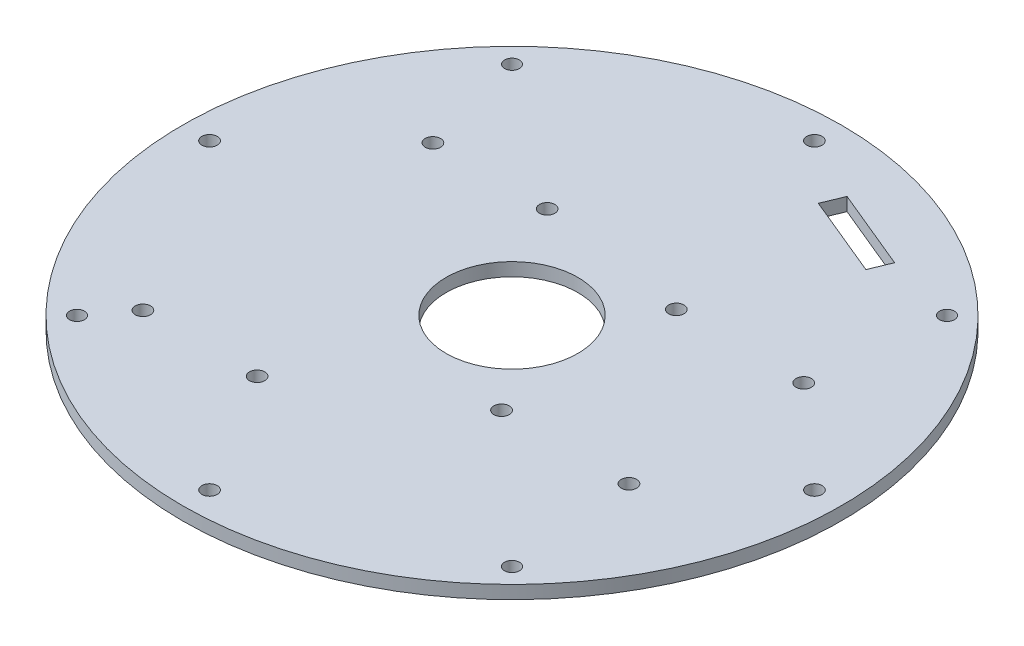
from build123d import *

# Parameters (mm, degrees)
SKETCH1_R           = 75
SKETCH1_R_2         = 1.7
SKETCH1_R_3         = 15
BOSS_EXTRUDE1_DEPTH = 3
SKETCH2_R           = 1.75
CUT_EXTRUDE2_DEPTH  = 107.108435103
SKETCH3_R           = 1.75
CUT_EXTRUDE3_DEPTH  = 107.108435103


with BuildPart() as part:
    # Sketch1 → Boss-Extrude1 (new body)
    with BuildSketch(Plane(origin=(0, 0, 0), x_dir=(1, 0, 0), z_dir=(0, 1, 0))):
        with Locations(Location((0, 0, 0), (0, 0, 270))):
            Circle(SKETCH1_R)
        with Locations(Location((49.497474683, 49.497474683, 0), (0, 0, 270))):
            Circle(SKETCH1_R_2, mode=Mode.SUBTRACT)
        with Locations(Location((-49.497474683, 49.497474683, 0), (0, 0, 270))):
            Circle(SKETCH1_R_2, mode=Mode.SUBTRACT)
        with Locations(Location((-49.497474683, -49.497474683, 0), (0, 0, 270))):
            Circle(SKETCH1_R_2, mode=Mode.SUBTRACT)
        with Locations(Location((49.497474683, -49.497474683, 0), (0, 0, 270))):
            Circle(SKETCH1_R_2, mode=Mode.SUBTRACT)
        with Locations(Location((0, 0, 0), (0, 0, 270))):
            Circle(SKETCH1_R_3, mode=Mode.SUBTRACT)
    extrude(amount=BOSS_EXTRUDE1_DEPTH)

    # Sketch2 → Cut-Extrude2 (cut, through all)
    with BuildSketch(Plane(origin=(0, 0, 0), x_dir=(1, 0, 0), z_dir=(0, 1, 0))):
        with Locations(Location((0, 68.825, 0), (0, 0, 270))):
            Circle(SKETCH2_R)
        with Locations(Location((68.825, 0, 0), (0, 0, 270))):
            Circle(SKETCH2_R)
        with Locations(Location((0, -68.825, 0), (0, 0, 270))):
            Circle(SKETCH2_R)
        with Locations(Location((-68.825, 0, 0), (0, 0, 270))):
            Circle(SKETCH2_R)
    extrude(amount=CUT_EXTRUDE2_DEPTH, mode=Mode.SUBTRACT)

    # Sketch3 → Cut-Extrude3 (cut, through all)
    with BuildSketch(Plane(origin=(0, 0, 0), x_dir=(1, 0, 0), z_dir=(0, 1, 0))):
        with Locations(Location((-43, 25, 0), (0, 0, 270))):
            Circle(SKETCH3_R)
        with Locations(Location((-17, 25, 0), (0, 0, 270))):
            Circle(SKETCH3_R)
        with Locations(Location((-17, -41, 0), (0, 0, 270))):
            Circle(SKETCH3_R)
        with Locations(Location((-43, -41, 0), (0, 0, 270))):
            Circle(SKETCH3_R)
        with Locations(Location((17.505557347, 19.884131141, 0), (0, 0, 270))):
            Circle(SKETCH3_R)
        with Locations(Location((46.494442653, -19.884131141, 0), (0, 0, 270))):
            Circle(SKETCH3_R)
        with Locations(Location((46.494442653, 19.884131141, 0), (0, 0, 270))):
            Circle(SKETCH3_R)
        with Locations(Location((17.505557347, -19.884131141, 0), (0, 0, 270))):
            Circle(SKETCH3_R)
        Polygon((31.243092686, 49.296238796), (12.765502036, 56.949907443), (14.678919198, 61.569305106), (33.156509848, 53.915636458), align=None)
    extrude(amount=CUT_EXTRUDE3_DEPTH, mode=Mode.SUBTRACT)


solid = part.part
